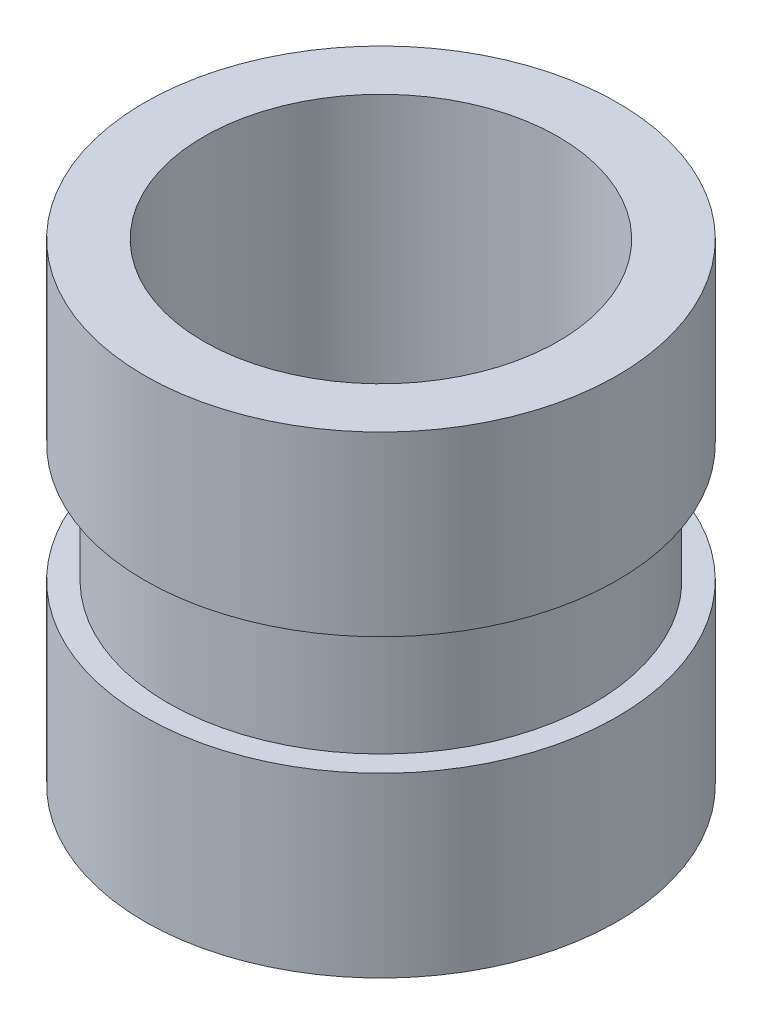
from build123d import *


with BuildPart() as part:
    # Sketch1 → Revolve1 (revolve)
    with BuildSketch(Plane.XY, mode=Mode.PRIVATE) as revolve1_sk:
        Polygon((1.5, 0), (2, 0), (2, 1.5), (1.8, 1.5), (1.8, 2.5), (2, 2.5), (2, 4), (1.5, 4), align=None)
    revolve(revolve1_sk.sketch.rotate(Axis((0, 4.902028775, 0), (0, -1, 0)), 90), axis=Axis((0, 4.902028775, 0), (0, -1, 0)))


solid = part.part
